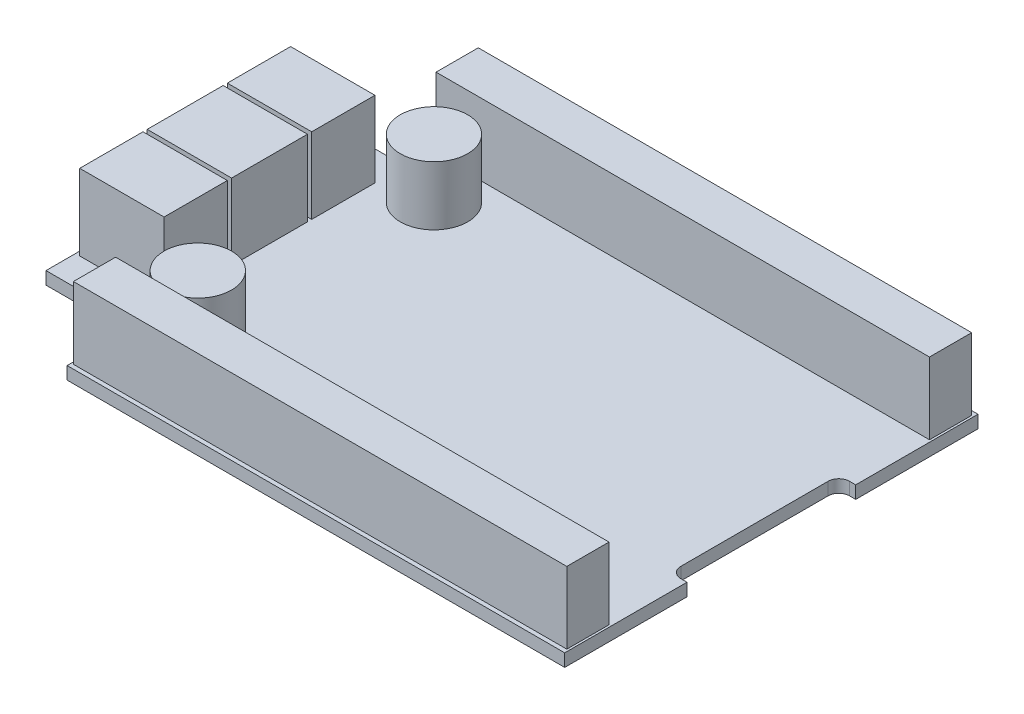
from build123d import *

# Parameters (mm, degrees)
BOSS_EXTRUDE1_DEPTH = 1.5
SKETCH2_W           = 58.49874
SKETCH2_H           = 5.00126
BOSS_EXTRUDE2_DEPTH = 8.5
SKETCH3_W           = 10
SKETCH3_H           = 7.5
SKETCH3_H_2         = 9
BOSS_EXTRUDE3_DEPTH = 9
SKETCH4_R           = 4
BOSS_EXTRUDE4_DEPTH = 7
FILLET1_R           = 2.54
FILLET2_R           = 1.27


with BuildPart() as part:
    # Sketch1 → Boss-Extrude1 (new body)
    with BuildSketch(Plane(origin=(0, 0, 0), x_dir=(1, 0, 0), z_dir=(0, 1, 0))):
        Polygon((-29.009375, 25.8421875), (29.990625, 25.8421875), (29.990625, 11.3421875), (27.990625, 11.3421875), (27.990625, -8.6578125), (29.990625, -8.6578125), (29.990625, -23.1578125), (-29.009375, -23.1578125), (-29.009375, -14.6578125), (-40.009375, -14.6578125), (-40.009375, 17.3421875), (-29.009375, 17.3421875), align=None)
    extrude(amount=BOSS_EXTRUDE1_DEPTH)

    # Sketch2 → Boss-Extrude2 (add)
    with BuildSketch(Plane(origin=(0, 1.5, 0), x_dir=(1, 0, 0), z_dir=(0, 1, 0))):
        with Locations((0.489995, -20.1571825)):
            Rectangle(SKETCH2_W, SKETCH2_H)
        with Locations((0.489995, 22.8415575)):
            Rectangle(SKETCH2_W, SKETCH2_H)
    extrude(amount=BOSS_EXTRUDE2_DEPTH)

    # Sketch3 → Boss-Extrude3 (add)
    with BuildSketch(Plane(origin=(0, 1.5, 0), x_dir=(1, 0, 0), z_dir=(0, 1, 0))):
        with Locations((-34.509375, 10.0921875)):
            Rectangle(SKETCH3_W, SKETCH3_H)
        with Locations((-34.509375, 1.3421875)):
            Rectangle(SKETCH3_W, SKETCH3_H_2)
        with Locations((-34.509375, -7.4078125)):
            Rectangle(SKETCH3_W, SKETCH3_H)
    extrude(amount=BOSS_EXTRUDE3_DEPTH)

    # Sketch4 → Boss-Extrude4 (add)
    with BuildSketch(Plane(origin=(0, 1.5, 0), x_dir=(1, 0, 0), z_dir=(0, 1, 0))):
        with Locations(Location((-24.009375, 15.3409275, 0), (0, 0, 90))):
            Circle(SKETCH4_R)
        with Locations(Location((-24.009375, -12.6565525, 0), (0, 0, 90))):
            Circle(SKETCH4_R)
    extrude(amount=BOSS_EXTRUDE4_DEPTH)

    # Fillet1
    fillet1_edges = [part.edges().sort_by_distance(p)[0] for p in [
        (-29.009375, 0.75, 14.6578125),
        (-29.009375, 0.75, -17.3421875),
    ]]
    fillet(fillet1_edges, radius=FILLET1_R)

    # Fillet2
    fillet2_edges = [part.edges().sort_by_distance(p)[0] for p in [
        (27.990625, 0.75, -11.3421875),
        (27.990625, 0.75, 8.6578125),
    ]]
    fillet(fillet2_edges, radius=FILLET2_R)


solid = part.part
